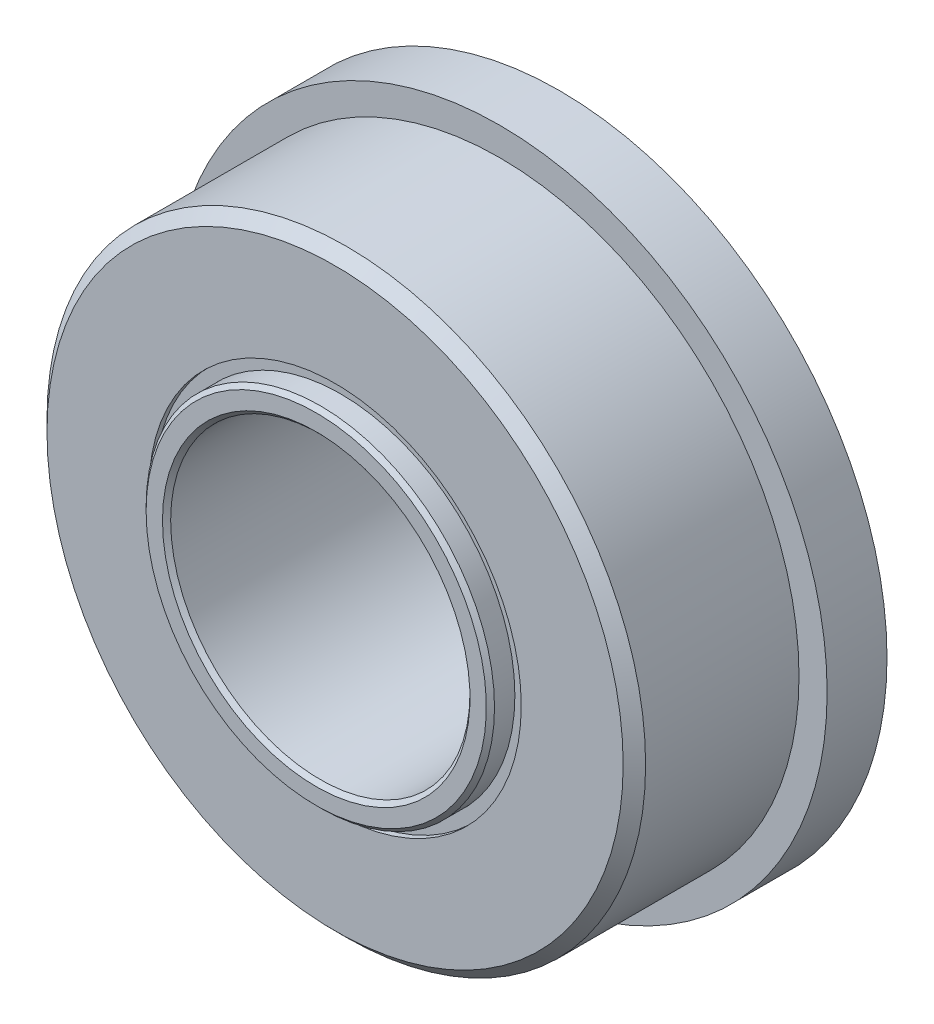
from build123d import *

# Parameters (mm, degrees)
CHAMFER1_SIZE     = 0.086783333
CIRPATTERN1_COUNT = 12
SKETCH5_W         = 1.4684375
SKETCH5_H         = 0.254
SKETCH6_W         = 1.27
SKETCH6_H         = 2.9972


with BuildPart() as part:
    # Sketch1 → Revolve1 (revolve)
    with BuildSketch(Plane(origin=(0, 0, 0), x_dir=(0, 0, -1), z_dir=(1, 0, 0)), mode=Mode.PRIVATE) as revolve1_sk:
        with BuildLine():
            Line((2.143125, 6.35), (-2.143125, 6.35))
            Line((-2.143125, 6.35), (-2.38125, 6.111875))
            Line((-2.38125, 6.111875), (-2.38125, 3.9497))
            Line((-2.38125, 3.9497), (-0.74295, 3.9497))
            ThreePointArc((-0.74295, 3.9497), (0, 5.02285), (0.74295, 3.9497))
            Line((0.74295, 3.9497), (2.38125, 3.9497))
            Line((2.38125, 3.9497), (2.38125, 6.111875))
            Line((2.38125, 6.111875), (2.143125, 6.35))
        make_face()
        with BuildLine():
            Line((2.7813, 3.6957), (0.587812472, 3.6957))
            ThreePointArc((0.587812472, 3.6957), (0, 3.43535), (-0.587812472, 3.6957))
            Line((-0.587812472, 3.6957), (-2.7813, 3.6957))
            Line((-2.7813, 3.6957), (-2.7813, 3.175))
            Line((-2.7813, 3.175), (2.7813, 3.175))
            Line((2.7813, 3.175), (2.7813, 3.6957))
        make_face()
    revolve(revolve1_sk.sketch.rotate(Axis((0, 0, 2.38125), (0, 0, -1)), 90), axis=Axis((0, 0, 2.38125), (0, 0, -1)))

    # Chamfer1
    chamfer1_edges = [part.edges().sort_by_distance(p)[0] for p in [
        (-3.6957, 0, -2.7813),
        (-3.175, 0, -2.7813),
        (-3.175, 0, 2.7813),
        (-3.6957, 0, 2.7813),
    ]]
    chamfer(chamfer1_edges, length=CHAMFER1_SIZE)

    # Sketch6 → Revolve6 (revolve)
    with BuildSketch(Plane(origin=(0, 0, 0), x_dir=(0, 0, -1), z_dir=(1, 0, 0)), mode=Mode.PRIVATE) as revolve6_sk:
        with Locations((1.74625, 5.4483)):
            Rectangle(SKETCH6_W, SKETCH6_H)
    revolve(revolve6_sk.sketch.rotate(Axis((0, 0, -2.38125), (0, 0, 1)), 90), axis=Axis((0, 0, -2.38125), (0, 0, 1)))


with BuildPart() as body_2:
    # Sketch4 → Revolve4 (revolve)
    with BuildSketch(Plane(origin=(0, 0, 0), x_dir=(0, 0, -1), z_dir=(1, 0, 0))):
        with BuildLine():
            Line((-0.79375, 4.2291), (0.79375, 4.2291))
            ThreePointArc((0.79375, 4.2291), (0, 5.02285), (-0.79375, 4.2291))
        make_face()
    revolve(axis=Axis((0, 4.2291, 0.79375), (0, 0, -1)))


with BuildPart() as cirpattern1_1:
    # CirPattern1: pattern copy
    add(body_2.part.rotate(Axis((0, 0, 0), (0, 0, 1)), 1 * 360 / CIRPATTERN1_COUNT))


with BuildPart() as cirpattern1_2:
    # CirPattern1: pattern copy
    add(body_2.part.rotate(Axis((0, 0, 0), (0, 0, 1)), 2 * 360 / CIRPATTERN1_COUNT))


with BuildPart() as cirpattern1_3:
    # CirPattern1: pattern copy
    add(body_2.part.rotate(Axis((0, 0, 0), (0, 0, 1)), 3 * 360 / CIRPATTERN1_COUNT))


with BuildPart() as cirpattern1_4:
    # CirPattern1: pattern copy
    add(body_2.part.rotate(Axis((0, 0, 0), (0, 0, 1)), 4 * 360 / CIRPATTERN1_COUNT))


with BuildPart() as cirpattern1_5:
    # CirPattern1: pattern copy
    add(body_2.part.rotate(Axis((0, 0, 0), (0, 0, 1)), 5 * 360 / CIRPATTERN1_COUNT))


with BuildPart() as cirpattern1_6:
    # CirPattern1: pattern copy
    add(body_2.part.rotate(Axis((0, 0, 0), (0, 0, 1)), 6 * 360 / CIRPATTERN1_COUNT))


with BuildPart() as cirpattern1_7:
    # CirPattern1: pattern copy
    add(body_2.part.rotate(Axis((0, 0, 0), (0, 0, 1)), 7 * 360 / CIRPATTERN1_COUNT))


with BuildPart() as cirpattern1_8:
    # CirPattern1: pattern copy
    add(body_2.part.rotate(Axis((0, 0, 0), (0, 0, 1)), 8 * 360 / CIRPATTERN1_COUNT))


with BuildPart() as cirpattern1_9:
    # CirPattern1: pattern copy
    add(body_2.part.rotate(Axis((0, 0, 0), (0, 0, 1)), 9 * 360 / CIRPATTERN1_COUNT))


with BuildPart() as cirpattern1_10:
    # CirPattern1: pattern copy
    add(body_2.part.rotate(Axis((0, 0, 0), (0, 0, 1)), 10 * 360 / CIRPATTERN1_COUNT))


with BuildPart() as cirpattern1_11:
    # CirPattern1: pattern copy
    add(body_2.part.rotate(Axis((0, 0, 0), (0, 0, 1)), 11 * 360 / CIRPATTERN1_COUNT))


with BuildPart() as body_14:
    # Sketch5 → Revolve5 (revolve)
    with BuildSketch(Plane(origin=(0, 0, 0), x_dir=(0, 0, -1), z_dir=(1, 0, 0)), mode=Mode.PRIVATE) as revolve5_sk:
        with Locations((-1.52796875, 3.8227)):
            Rectangle(SKETCH5_W, SKETCH5_H)
        with Locations((1.52796875, 3.8227)):
            Rectangle(SKETCH5_W, SKETCH5_H)
    revolve(revolve5_sk.sketch.rotate(Axis((0, 0, 2.38125), (0, 0, -1)), 90), axis=Axis((0, 0, 2.38125), (0, 0, -1)))


solid = Compound([part.part, body_2.part, cirpattern1_1.part, cirpattern1_2.part, cirpattern1_3.part, cirpattern1_4.part, cirpattern1_5.part, cirpattern1_6.part, cirpattern1_7.part, cirpattern1_8.part, cirpattern1_9.part, cirpattern1_10.part, cirpattern1_11.part, body_14.part])
